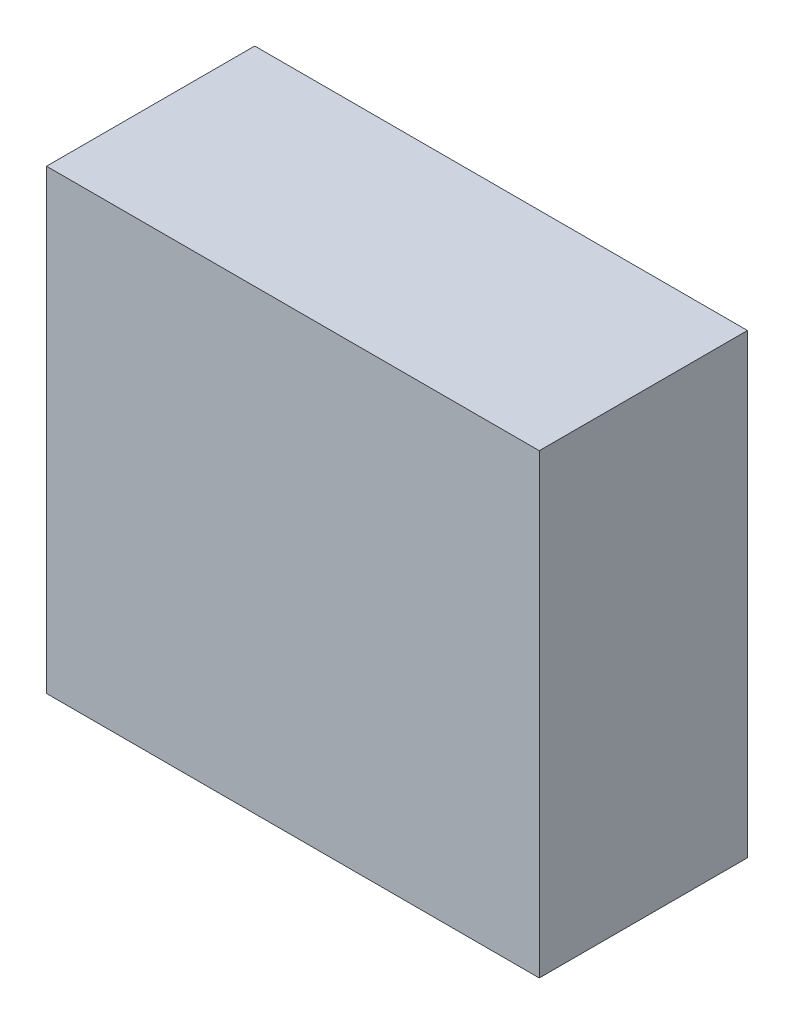
from build123d import *

# Parameters (mm, degrees)
SKETCH2_W           = 180.34
SKETCH2_H           = 76.2
BOSS_EXTRUDE1_DEPTH = 167.132


with BuildPart() as part:
    # Sketch2 → Boss-Extrude1 (new body)
    with BuildSketch(Plane(origin=(0, 0, 0), x_dir=(1, 0, 0), z_dir=(0, 1, 0))):
        with Locations((90.17, 38.1)):
            Rectangle(SKETCH2_W, SKETCH2_H)
    extrude(amount=BOSS_EXTRUDE1_DEPTH)


solid = part.part
